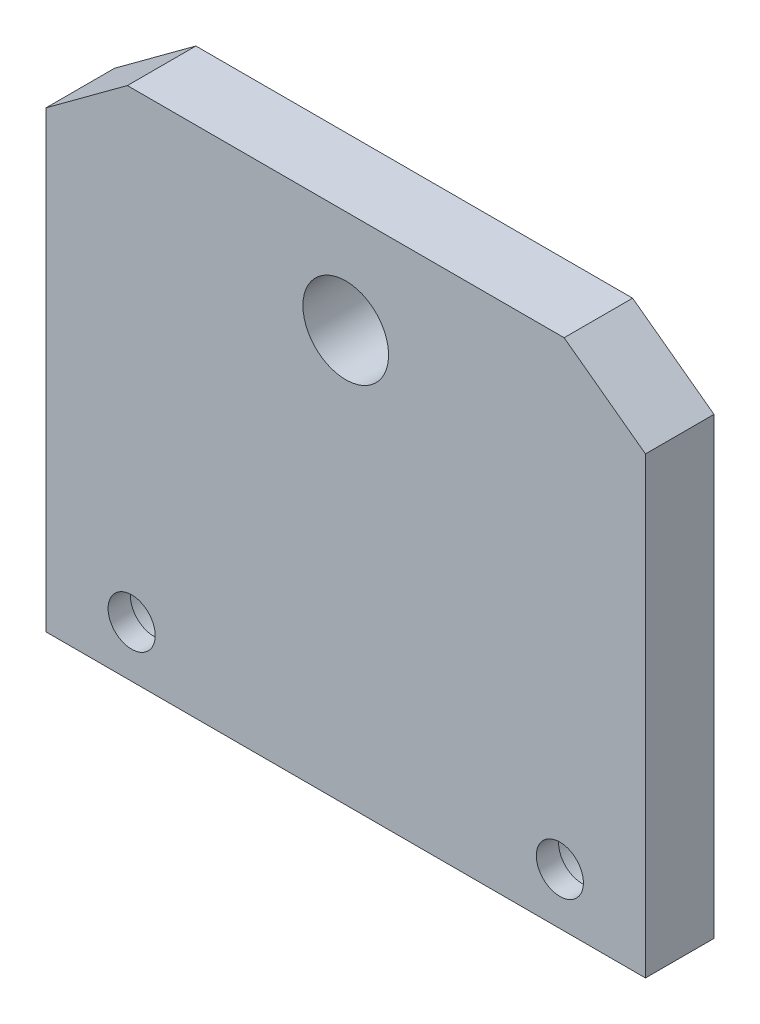
from build123d import *

# Parameters (mm, degrees)
SKETCH1_W               = 70
SKETCH1_H               = 60
BOSS_EXTRUDE2_DEPTH     = 8
CUT_EXTRUDE3_DEPTH      = 37
CUT_EXTRUDE3_DEPTH_BACK = 30
SKETCH1_5_R             = 2.75
CUT_EXTRUDE4_DEPTH      = 30
CUT_EXTRUDE4_DEPTH_BACK = 30
SKETCH1_7_R             = 2.75
CUT_EXTRUDE5_DEPTH      = 42
CUT_EXTRUDE5_DEPTH_BACK = 88
SKETCH1_8_R             = 5
CUT_EXTRUDE6_DEPTH      = 42
SKETCH1_9_R             = 5
CUT_EXTRUDE7_DEPTH      = 5.4
SKETCH1_10_R            = 5
CUT_EXTRUDE8_DEPTH      = 5.4


with BuildPart() as part:
    # Sketch1 → Boss-Extrude2 (new body)
    with BuildSketch(Plane.XY):
        with Locations((-22.732855119, 15.168432036)):
            Rectangle(SKETCH1_W, SKETCH1_H)
    extrude(amount=BOSS_EXTRUDE2_DEPTH)

    # Sketch1<5> → Cut-Extrude3 (cut, two sides: drawn at the far end of the back side and taken through both)
    with BuildSketch(Plane.XY.offset(-CUT_EXTRUDE3_DEPTH_BACK)):
        with Locations((-47.732855119, -8.831567964)):
            Circle(SKETCH1_5_R)
    extrude(amount=CUT_EXTRUDE3_DEPTH + CUT_EXTRUDE3_DEPTH_BACK, mode=Mode.SUBTRACT)

    # Sketch1<7> → Cut-Extrude4 (cut, two sides: drawn at the far end of the back side and taken through both)
    with BuildSketch(Plane.XY.offset(-CUT_EXTRUDE4_DEPTH_BACK)):
        with Locations((2.267144881, -8.831567964)):
            Circle(SKETCH1_7_R)
    extrude(amount=CUT_EXTRUDE4_DEPTH + CUT_EXTRUDE4_DEPTH_BACK, mode=Mode.SUBTRACT)

    # Sketch1<8> → Cut-Extrude5 (cut, two sides: drawn at the far end of the back side and taken through both)
    with BuildSketch(Plane.XY.offset(-CUT_EXTRUDE5_DEPTH_BACK)):
        with Locations((-22.732855119, 33.168432036)):
            Circle(SKETCH1_8_R)
    extrude(amount=CUT_EXTRUDE5_DEPTH + CUT_EXTRUDE5_DEPTH_BACK, mode=Mode.SUBTRACT)

    # Sketch3 → Cut-Extrude6 (cut)
    with BuildSketch(Plane.XY.offset(8)):
        Polygon((-48.232855119, 45.168432036), (-57.732855119, 38.168432036), (-57.732855119, 45.168432036), align=None)
        Polygon((2.767144881, 45.168432036), (12.267144881, 38.168432036), (12.267144881, 45.168432036), align=None)
    extrude(amount=-CUT_EXTRUDE6_DEPTH, mode=Mode.SUBTRACT)

    # Sketch1<9> → Cut-Extrude7 (cut)
    with BuildSketch(Plane.XY):
        with Locations((-47.732855119, -8.831567964)):
            Circle(SKETCH1_9_R)
    extrude(amount=CUT_EXTRUDE7_DEPTH, mode=Mode.SUBTRACT)

    # Sketch1<10> → Cut-Extrude8 (cut)
    with BuildSketch(Plane.XY):
        with Locations((2.267144881, -8.831567964)):
            Circle(SKETCH1_10_R)
    extrude(amount=CUT_EXTRUDE8_DEPTH, mode=Mode.SUBTRACT)


solid = part.part
